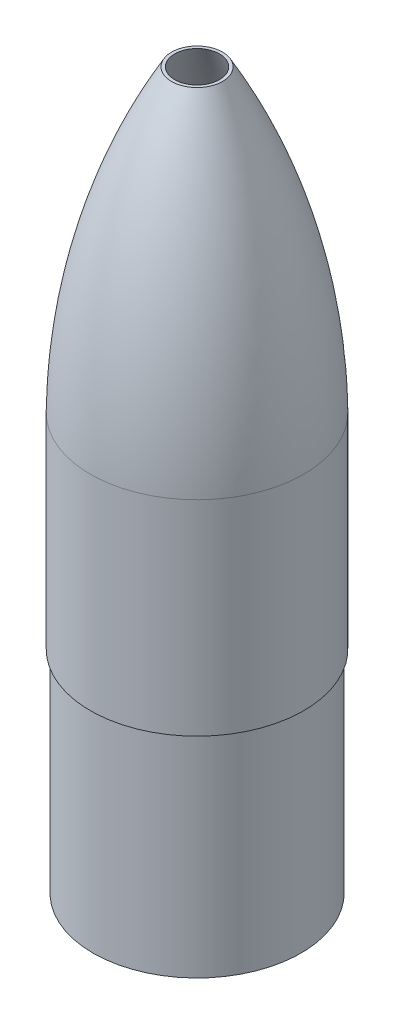
from build123d import *

# Parameters (mm, degrees)
BOSS_EXTRUDE1_START = -304.8
SKETCH2_R           = 76.2
SKETCH2_R_2         = 73.2
BOSS_EXTRUDE1_DEPTH = 304.8
SKETCH3_R           = 126.460441223
CUT_EXTRUDE1_DEPTH  = 30


with BuildPart() as part:
    # Sketch1 → Revolve3 (revolve)
    with BuildSketch(Plane.XY, mode=Mode.PRIVATE) as revolve3_sk:
        with BuildLine():
            Line((78.16, 0.555796301), (78.16, 150.555796301))
            add(Edge.make_bspline(
                [(0, 400), (0.211335822, 399.688125951), (0.635814895, 399.059576984), (1.538100901, 397.718447682), (2.522216135, 396.240558988), (3.505644669, 394.750882712), (4.501021999, 393.230772914), (5.482794304, 391.717940875), (6.460002487, 390.1990457), (7.436503499, 388.667903295), (8.412102246, 387.124567018), (16.491350088, 374.228806244), (28.348045348, 353.344444451), (42.541088503, 323.752786496), (57.529234868, 282.998416237), (68.449765851, 242.872883661), (74.109605793, 210.076821303), (76.655852831, 184.808563), (77.518465345, 170.067485067), (77.680444963, 166.851372886), (77.80019329, 164.105278722), (77.872037245, 162.29067577), (77.936311693, 160.485721023), (77.993377873, 158.683168323), (78.043426294, 156.866740105), (78.085914262, 155.082628956), (78.121127528, 153.306463123), (78.145475643, 151.691137071), (78.155577952, 150.932503957), (78.16, 150.555796301)],
                knots=[0.082616428, 0.082616428, 0.082616428, 0.082616428, 0.082616428, 0.088299706, 0.093982984, 0.099666263, 0.105349541, 0.111032819, 0.116716097, 0.122399375, 0.128082653, 0.133891142, 0.139699631, 0.313954311, 0.430124092, 0.546293874, 0.685697612, 0.836718331, 0.848335309, 0.865760775, 0.871569264, 0.877252541, 0.882935819, 0.888619096, 0.894302373, 0.899985651, 0.905668928, 0.911352205, 0.917035483, 0.917035483, 0.917035483, 0.917035483, 0.917035483], degree=4))
            Line((0, 400), (0, 396.489212171))
            add(Edge.make_bspline(
                [(0, 396.489212171), (0.033950421, 396.438447854), (0.270297298, 396.084910627), (0.687269239, 395.458986868), (1.248256795, 394.612262217), (1.999478916, 393.472916562), (3.322990367, 391.451301251), (5.182734219, 388.567106013), (9.592096746, 381.590651127), (18.79448878, 366.267083026), (36.794305295, 332.203153979), (57.076508975, 280.924103704), (69.684732597, 227.240425292), (74.343019544, 188.995844434), (75.530951553, 171.160960641), (75.891349594, 162.915707977), (76.010098219, 159.486050775), (76.07694035, 157.070550778), (76.110246707, 155.706228582), (76.132780312, 154.690650434), (76.153251031, 153.650034533), (76.172421756, 152.520648044), (76.189027326, 151.409738144), (76.196427769, 150.847643517), (76.2, 150.54427492)],
                knots=[0.091851146, 0.091851146, 0.091851146, 0.091851146, 0.092394266, 0.095653545, 0.098912824, 0.102172103, 0.108690662, 0.121727778, 0.134764895, 0.186913362, 0.291210296, 0.499804164, 0.708398032, 0.812694966, 0.864843432, 0.877880549, 0.890917666, 0.897436224, 0.900695504, 0.903954783, 0.907214062, 0.910473341, 0.91373262, 0.916991899, 0.916991899, 0.916991899, 0.916991899], degree=3))
            Line((76.2, 150.54427492), (76.2, 0.555796301))
            Line((76.2, 0.555796301), (78.16, 0.555796301))
        make_face()
    revolve(revolve3_sk.sketch.rotate(Axis((0, -198.817850362, 0), (0, -1, 0)), 90), axis=Axis((0, -198.817850362, 0), (0, -1, 0)))

    # Sketch2 → Boss-Extrude1 (add)
    with BuildSketch(Plane(origin=(0, 150.555796301, 0), x_dir=(1, 0, 0), z_dir=(0, 1, 0)).offset(BOSS_EXTRUDE1_START)):
        with Locations(Location((0, 0, 0), (0, 0, 270))):
            Circle(SKETCH2_R)
        with Locations(Location((0, 0, 0), (0, 0, 270))):
            Circle(SKETCH2_R_2, mode=Mode.SUBTRACT)
    extrude(amount=BOSS_EXTRUDE1_DEPTH)

    # Sketch3 → Cut-Extrude1 (cut)
    with BuildSketch(Plane(origin=(0, 400, 0), x_dir=(-1, 0, 0), z_dir=(0, -1, 0))):
        Circle(SKETCH3_R)
    extrude(amount=CUT_EXTRUDE1_DEPTH, mode=Mode.SUBTRACT)


solid = part.part
